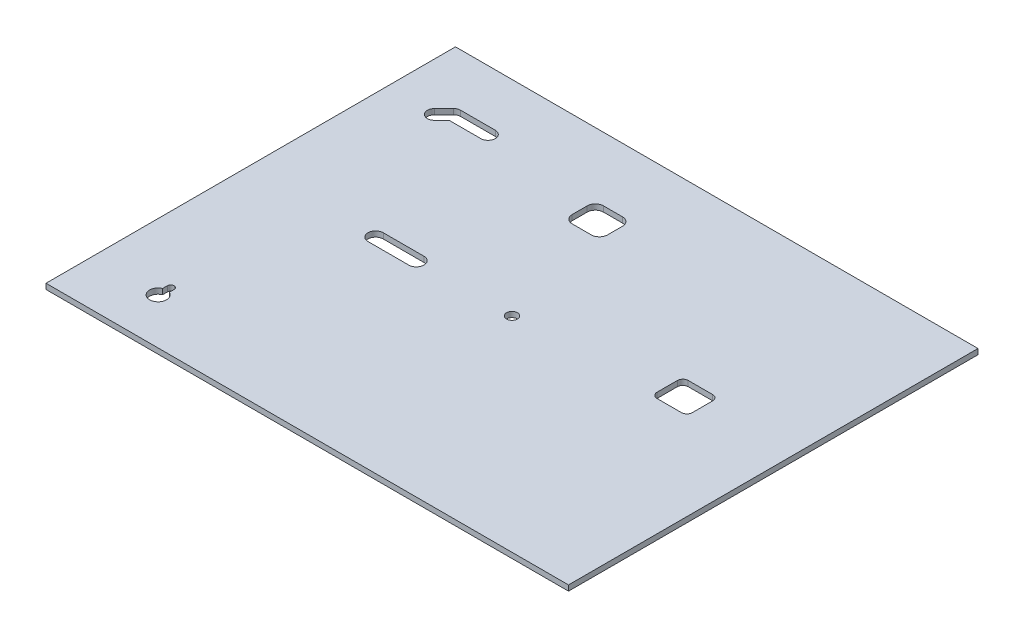
from build123d import *

# Parameters (mm, degrees)
SKETCH1_W               = 1922.702167778
SKETCH1_H               = 1506.854577214
BOSS_EXTRUDE1_DEPTH     = 20
SKETCH2_R               = 20.121201263
CUT_EXTRUDE1_DEPTH      = 20
CUT_EXTRUDE2_DEPTH      = 1222.576270935
CUT_EXTRUDE3_DEPTH      = 1222.576270935
CUT_EXTRUDE4_DEPTH      = 1222.576270935
CUT_EXTRUDE4_DEPTH_BACK = 1222.576270935
CUT_EXTRUDE5_DEPTH      = 1222.576270935
CUT_EXTRUDE6_DEPTH      = 1222.576270935


with BuildPart() as part:
    # Sketch1 → Boss-Extrude1 (new body)
    with BuildSketch(Plane(origin=(0, 0, 0), x_dir=(1, 0, 0), z_dir=(0, 1, 0))):
        Rectangle(SKETCH1_W, SKETCH1_H)
    extrude(amount=BOSS_EXTRUDE1_DEPTH)

    # Sketch2 → Cut-Extrude1 (cut)
    with BuildSketch(Plane(origin=(0, 20, 0), x_dir=(1, 0, 0), z_dir=(0, 1, 0))):
        with Locations(Location((0, 0, 0), (0, 0, 270))):
            Circle(SKETCH2_R)
    extrude(amount=-CUT_EXTRUDE1_DEPTH, mode=Mode.SUBTRACT)

    # Sketch3 → Cut-Extrude2 (cut, through all)
    with BuildSketch(Plane(origin=(0, 20, 0), x_dir=(1, 0, 0), z_dir=(0, 1, 0))):
        with BuildLine():
            Line((-501.853893247, 28.082670062), (-351.853893247, 28.082670062))
            ThreePointArc((-351.853893247, 28.082670062), (-323.771223185, 0), (-351.853893247, -28.082670062))
            Line((-351.853893247, -28.082670062), (-501.853893247, -28.082670062))
            ThreePointArc((-501.853893247, -28.082670062), (-529.936563308, 0), (-501.853893247, 28.082670062))
        make_face()
    extrude(amount=-CUT_EXTRUDE2_DEPTH, mode=Mode.SUBTRACT)

    # Sketch4 → Cut-Extrude3 (cut, through all)
    with BuildSketch(Plane(origin=(0, 20, 0), x_dir=(1, 0, 0), z_dir=(0, 1, 0))):
        with BuildLine():
            Line((530.111507452, 3.430580165), (620.111507452, 3.430580165))
            ThreePointArc((620.111507452, 3.430580165), (634.253643076, 9.288444541), (640.111507452, 23.430580165))
            Line((640.111507452, 23.430580165), (640.111507452, 98.430580165))
            ThreePointArc((640.111507452, 98.430580165), (634.253643076, 112.572715788), (620.111507452, 118.430580165))
            Line((620.111507452, 118.430580165), (530.111507452, 118.430580165))
            ThreePointArc((530.111507452, 118.430580165), (515.969371828, 112.572715788), (510.111507452, 98.430580165))
            Line((510.111507452, 98.430580165), (510.111507452, 23.430580165))
            ThreePointArc((510.111507452, 23.430580165), (515.969371828, 9.288444541), (530.111507452, 3.430580165))
        make_face()
    extrude(amount=-CUT_EXTRUDE3_DEPTH, mode=Mode.SUBTRACT)

    # Sketch5 → Cut-Extrude4 (cut, two sides: drawn at the far end of the back side and taken through both)
    with BuildSketch(Plane(origin=(0, 20, 0), x_dir=(1, 0, 0), z_dir=(0, 1, 0)).offset(-CUT_EXTRUDE4_DEPTH_BACK)):
        with BuildLine():
            Line((-182.264012939, 403.894827106), (-112.264012939, 403.894827106))
            ThreePointArc((-112.264012939, 403.894827106), (-91.050809503, 412.681623671), (-82.264012939, 433.894827106))
            Line((-82.264012939, 433.894827106), (-82.264012939, 488.894827106))
            ThreePointArc((-82.264012939, 488.894827106), (-91.050809503, 510.108030542), (-112.264012939, 518.894827106))
            Line((-112.264012939, 518.894827106), (-182.264012939, 518.894827106))
            ThreePointArc((-182.264012939, 518.894827106), (-203.477216375, 510.108030542), (-212.264012939, 488.894827106))
            Line((-212.264012939, 488.894827106), (-212.264012939, 433.894827106))
            ThreePointArc((-212.264012939, 433.894827106), (-203.477216375, 412.681623671), (-182.264012939, 403.894827106))
        make_face()
    extrude(amount=CUT_EXTRUDE4_DEPTH + CUT_EXTRUDE4_DEPTH_BACK, mode=Mode.SUBTRACT)

    # Sketch6 → Cut-Extrude5 (cut, through all)
    with BuildSketch(Plane(origin=(0, 20, 0), x_dir=(1, 0, 0), z_dir=(0, 1, 0))):
        with BuildLine():
            Line((-803.044857879, 518.477090235), (-768.447719913, 553.074228201))
            ThreePointArc((-768.447719913, 553.074228201), (-759.794991438, 558.855796528), (-749.588402288, 560.886013339))
            Line((-749.588402288, 560.886013339), (-622.318858343, 560.886013339))
            ThreePointArc((-622.318858343, 560.886013339), (-595.647755579, 534.214910576), (-622.318858343, 507.543807813))
            Line((-622.318858343, 507.543807813), (-738.5408698, 507.543807813))
            Line((-738.5408698, 507.543807813), (-765.326222628, 480.758454984))
            ThreePointArc((-765.326222628, 480.758454984), (-803.044857879, 480.758454984), (-803.044857879, 518.477090235))
        make_face()
    extrude(amount=-CUT_EXTRUDE5_DEPTH, mode=Mode.SUBTRACT)

    # Sketch8 → Cut-Extrude6 (cut, through all)
    with BuildSketch(Plane(origin=(0, 20, 0), x_dir=(1, 0, 0), z_dir=(0, 1, 0))):
        with BuildLine():
            Line((-730.19585764, -555.467097942), (-730.19585764, -537.888913931))
            ThreePointArc((-730.19585764, -537.888913931), (-717.979020313, -525.672076605), (-705.762182987, -537.888913931))
            Line((-705.762182987, -537.888913931), (-705.762182987, -555.467097942))
            ThreePointArc((-705.762182987, -555.467097942), (-717.979020313, -615.594356546), (-730.19585764, -555.467097942))
        make_face()
    extrude(amount=-CUT_EXTRUDE6_DEPTH, mode=Mode.SUBTRACT)


solid = part.part
